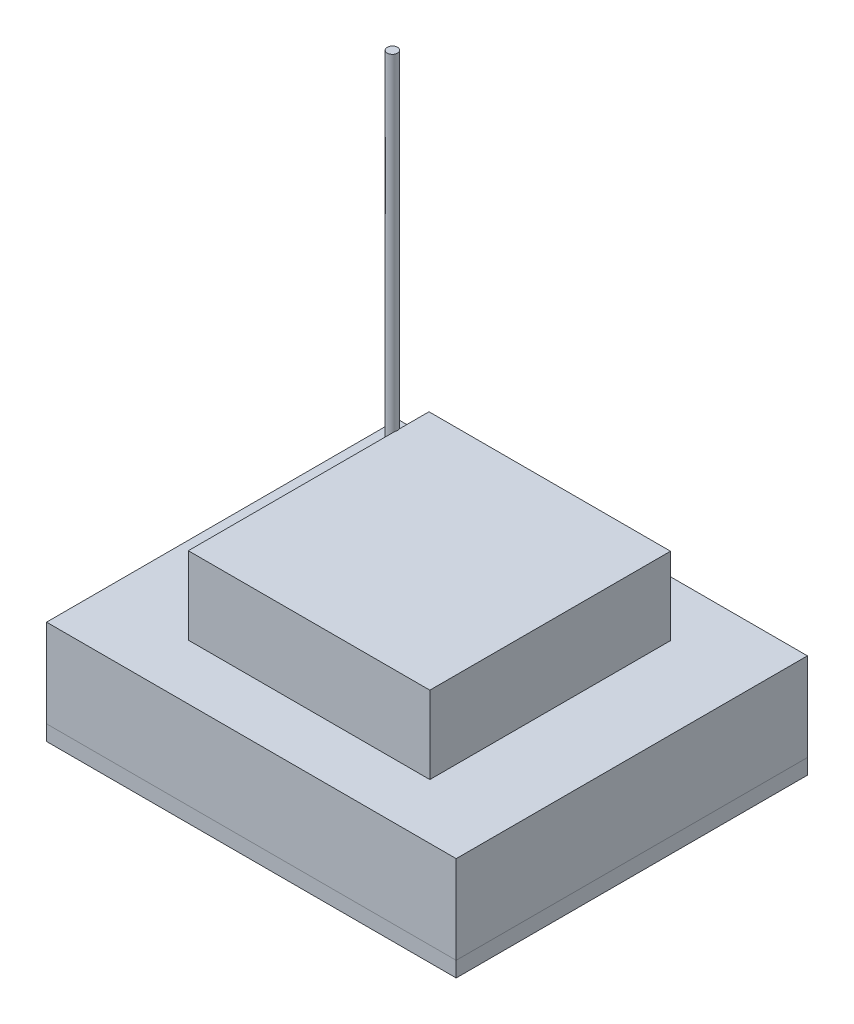
from build123d import *

# Parameters (mm, degrees)
SKETCH1_W           = 1018.6
SKETCH1_H           = 218.967
BOSS_EXTRUDE1_DEPTH = 436.75
SKETCH2_W           = 600.6
SKETCH2_H           = 192.56
BOSS_EXTRUDE2_DEPTH = 299.25
SKETCH3_R           = 12.7
BOSS_EXTRUDE5_DEPTH = 1005.06
SKETCH4_W           = 1018.6
SKETCH4_H           = 873.5
BOSS_EXTRUDE6_DEPTH = 38.1


with BuildPart() as part:
    # Sketch1 → Boss-Extrude1 (new, symmetric)
    with BuildSketch(Plane.XY):
        Rectangle(SKETCH1_W, SKETCH1_H)
    extrude(amount=BOSS_EXTRUDE1_DEPTH, both=True)

    # Sketch2 → Boss-Extrude2 (add, symmetric)
    with BuildSketch(Plane.XY):
        with Locations((6, 205.7635)):
            Rectangle(SKETCH2_W, SKETCH2_H)
    extrude(amount=BOSS_EXTRUDE2_DEPTH, both=True)

    # Sketch3 → Boss-Extrude5 (add)
    with BuildSketch(Plane(origin=(0, 109.4835, 0), x_dir=(1, 0, 0), z_dir=(0, 1, 0))):
        with Locations(Location((-306, 219.95, 0), (0, 0, 22.889037196))):
            Circle(SKETCH3_R)
    extrude(amount=BOSS_EXTRUDE5_DEPTH)


with BuildPart() as body_2:
    # Sketch4 → Boss-Extrude6 (new body)
    with BuildSketch(Plane.XZ.offset(109.4835)):
        Rectangle(SKETCH4_W, SKETCH4_H)
    extrude(amount=BOSS_EXTRUDE6_DEPTH)


solid = Compound([part.part, body_2.part])
